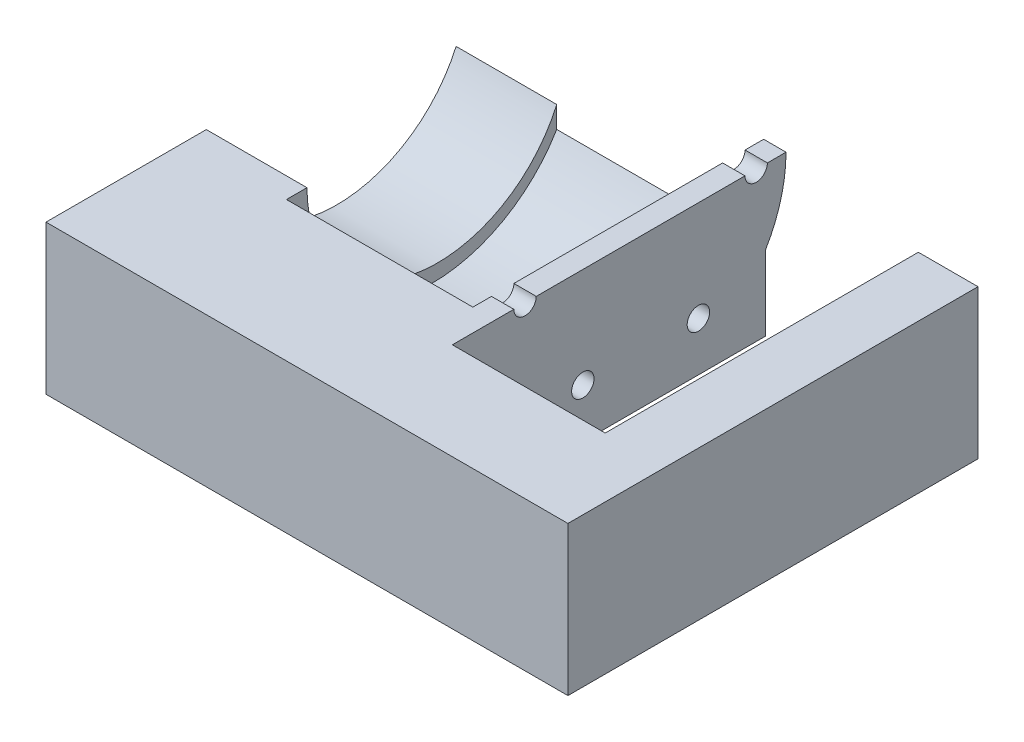
from build123d import *

# Parameters (mm, degrees)
SKETCH1_W           = 70
SKETCH1_H           = 55
BOSS_EXTRUDE1_DEPTH = 20
SKETCH2_R           = 26
CUT_EXTRUDE1_DEPTH  = 20.5
SKETCH3_R           = 17.5
CUT_EXTRUDE2_DEPTH  = 13.5
SKETCH5_R           = 19.5
CUT_EXTRUDE3_DEPTH  = 28
SKETCH6_R           = 1.503081696
BOSS_EXTRUDE2_DEPTH = 3


with BuildPart() as part:
    # Sketch1 → Boss-Extrude1 (new body)
    with BuildSketch(Plane(origin=(0, 0, 0), x_dir=(1, 0, 0), z_dir=(0, 1, 0))):
        with Locations((35, -27.5)):
            Rectangle(SKETCH1_W, SKETCH1_H)
    extrude(amount=BOSS_EXTRUDE1_DEPTH)

    # Sketch2 → Cut-Extrude1 (cut)
    with BuildSketch(Plane(origin=(62, 0, 0), x_dir=(0, 0, -1), z_dir=(1, 0, 0))):
        with Locations((-16, 20)):
            Circle(SKETCH2_R)
    extrude(amount=-CUT_EXTRUDE1_DEPTH, mode=Mode.SUBTRACT)

    # Sketch3 → Cut-Extrude2 (cut)
    with BuildSketch(Plane.ZY):
        with Locations((16, 20)):
            Circle(SKETCH3_R)
    extrude(amount=-CUT_EXTRUDE2_DEPTH, mode=Mode.SUBTRACT)

    # Sketch5 → Cut-Extrude3 (cut)
    with BuildSketch(Plane.ZY.offset(-13.5)):
        with Locations((16.75, 20)):
            Circle(SKETCH5_R)
    extrude(amount=-CUT_EXTRUDE3_DEPTH, mode=Mode.SUBTRACT)

    # Sketch6 → Boss-Extrude2 (add)
    with BuildSketch(Plane(origin=(38.5, 0, 0), x_dir=(0, 0, -1), z_dir=(1, 0, 0))):
        with BuildLine():
            Line((2.75, 20), (0.253081696, 20))
            ThreePointArc((0.253081696, 20), (-1.25, 18.496918304), (-2.753081696, 20))
            Line((-2.753081696, 20), (-30.746918304, 20))
            ThreePointArc((-30.746918304, 20), (-32.25, 18.496918304), (-33.753081696, 20))
            Line((-33.753081696, 20), (-36.25, 20))
            ThreePointArc((-36.25, 20), (-16.75, 0.5), (2.75, 20))
        make_face()
        with Locations((-9, 6.576606241)):
            Circle(SKETCH6_R, mode=Mode.SUBTRACT)
        with Locations((-24.5, 6.576606241)):
            Circle(SKETCH6_R, mode=Mode.SUBTRACT)
    extrude(amount=BOSS_EXTRUDE2_DEPTH)


solid = part.part
